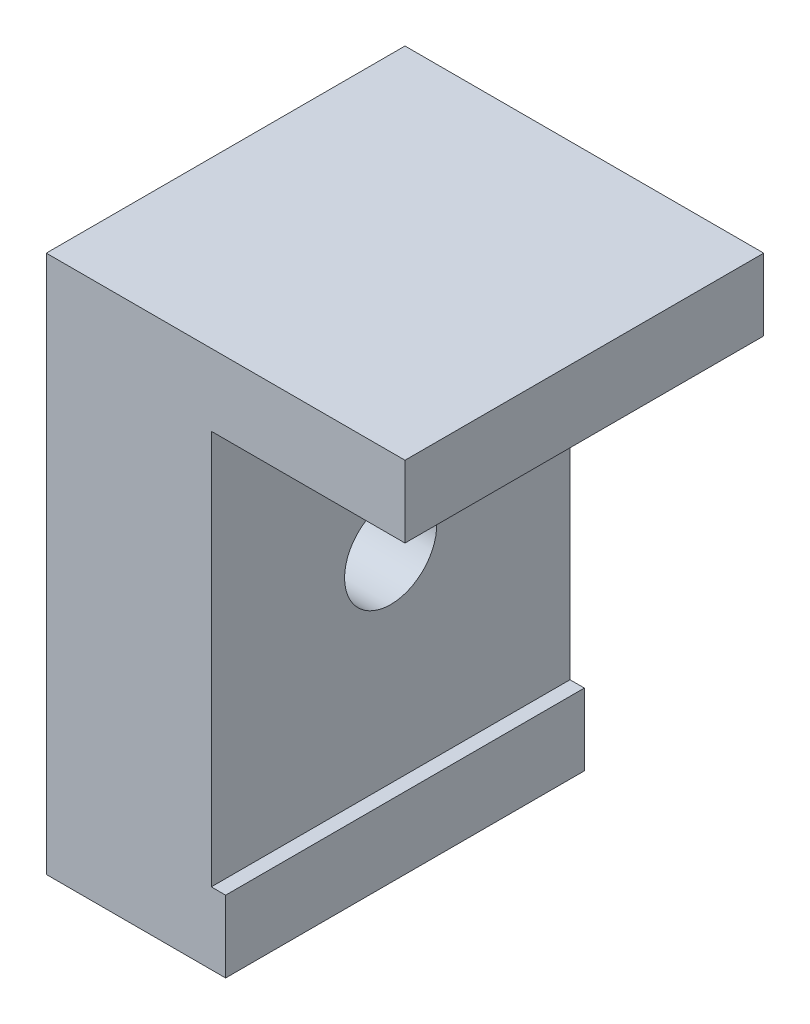
from build123d import *

# Parameters (mm, degrees)
SKETCH1_W             = 12.7
SKETCH1_H             = 19.05
BOSS_EXTRUDE1_DEPTH   = 12.7
SKETCH2_W             = 6.35
SKETCH2_H             = 16.51
CUT_EXTRUDE1_DEPTH    = 21.329919454
SKETCH3_W             = 0.508
SKETCH3_H             = 13.97
CUT_EXTRUDE2_DEPTH    = 21.329919454
F_4_CLEARANCE_HOLE1_D = 3.2639


with BuildPart() as part:
    # Sketch1 → Boss-Extrude1 (new body)
    with BuildSketch(Plane(origin=(0, 0, 0), x_dir=(0, 0, -1), z_dir=(1, 0, 0))):
        Rectangle(SKETCH1_W, SKETCH1_H)
    extrude(amount=BOSS_EXTRUDE1_DEPTH)

    # Sketch2 → Cut-Extrude1 (cut, through all)
    with BuildSketch(Plane.XY.offset(6.35)):
        with Locations((9.525, -1.27)):
            Rectangle(SKETCH2_W, SKETCH2_H)
    extrude(amount=-CUT_EXTRUDE1_DEPTH, mode=Mode.SUBTRACT)

    # Sketch3 → Cut-Extrude2 (cut, through all)
    with BuildSketch(Plane.XY.offset(6.35)):
        with Locations((6.096, 0)):
            Rectangle(SKETCH3_W, SKETCH3_H)
    extrude(amount=-CUT_EXTRUDE2_DEPTH, mode=Mode.SUBTRACT)

    # #4 Clearance Hole1 (through all)
    with Locations(Plane.ZY):
        with Locations((0, 0.127)):
            Hole(F_4_CLEARANCE_HOLE1_D / 2)


solid = part.part
